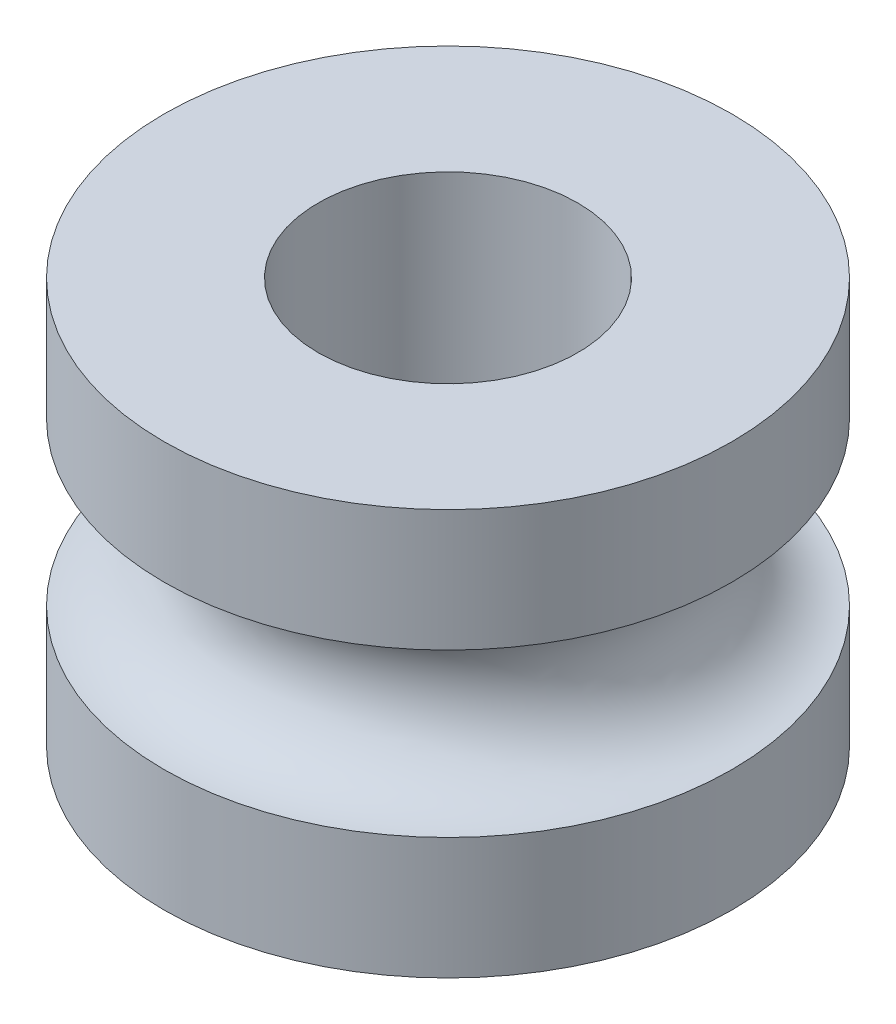
from build123d import *


with BuildPart() as part:
    # Sketch1 → Revolve1 (revolve)
    with BuildSketch(Plane.XY, mode=Mode.PRIVATE) as revolve1_sk:
        with BuildLine():
            Line((-1.6, 2.5), (-3.5, 2.5))
            Line((-3.5, 2.5), (-3.5, 1))
            ThreePointArc((-3.5, 1), (-2.5, 0), (-3.5, -1))
            Line((-3.5, -1), (-3.5, -2.5))
            Line((-3.5, -2.5), (-1.6, -2.5))
            Line((-1.6, -2.5), (-1.6, 2.5))
        make_face()
    revolve(revolve1_sk.sketch.rotate(Axis((0, 2.75, 0), (0, -1, 0)), 270), axis=Axis((0, 2.75, 0), (0, -1, 0)))


solid = part.part
